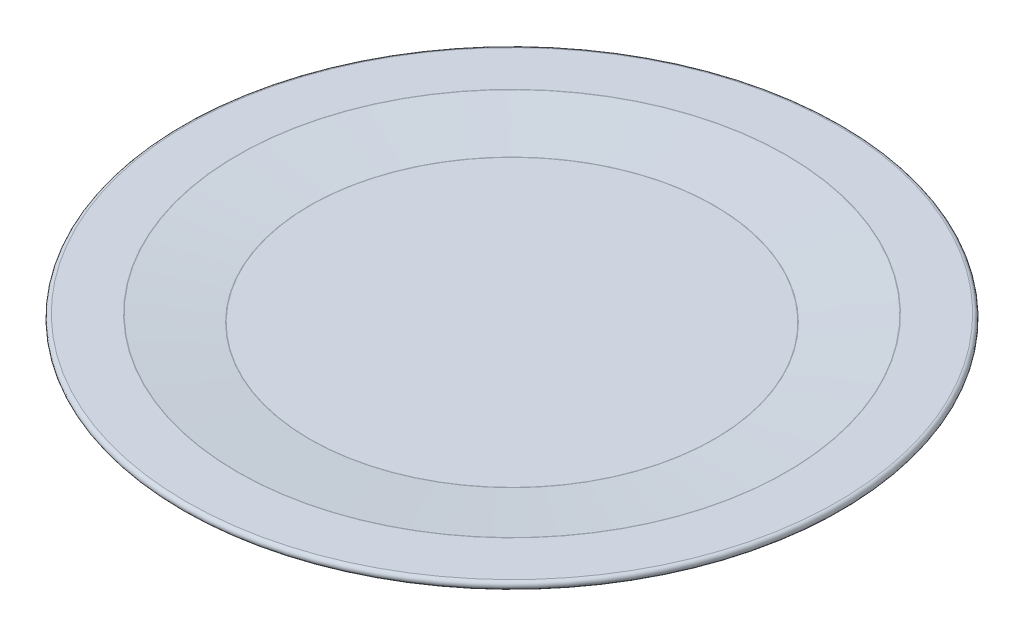
from build123d import *

# Parameters (mm, degrees)
SKETCH1_R           = 203.2
BOSS_EXTRUDE1_DEPTH = 12.7
BOSS_EXTRUDE1_DRAFT = -63.999999999
SKETCH2_R           = 183.871225213
CUT_EXTRUDE1_DEPTH  = 5.08
CUT_EXTRUDE1_DRAFT  = -83.999999999
FILLET1_R           = 2.54
SCALE1_SCALE        = 0.582


with BuildPart() as part:
    # Sketch1 → Boss-Extrude1 (with draft: the straight prism first)
    with BuildSketch(Plane(origin=(0, 0, 0), x_dir=(1, 0, 0), z_dir=(0, 1, 0))):
        Circle(SKETCH1_R)
    extrude(amount=BOSS_EXTRUDE1_DEPTH)
    # Boss-Extrude1: the draft: its side faces are tilted about the plane it starts from
    boss_extrude1_sides = [part.faces().sort_by_distance(p)[0] for p in [
        (-203.2, 6.35, 0),
    ]]
    draft(boss_extrude1_sides, Plane(origin=(0, 0, 0), x_dir=(1, 0, 0), z_dir=(0, 1, 0)), BOSS_EXTRUDE1_DRAFT)


with BuildPart() as cut_extrude1_tool:
    # Sketch2 → Cut-Extrude1 (with draft: the straight prism first)
    with BuildSketch(Plane(origin=(0, 12.7, 0), x_dir=(1, 0, 0), z_dir=(0, 1, 0))):
        Circle(SKETCH2_R)
    extrude(amount=-CUT_EXTRUDE1_DEPTH)
    # Cut-Extrude1: the draft: its side faces are tilted about the plane it starts from
    cut_extrude1_sides = [cut_extrude1_tool.faces().sort_by_distance(p)[0] for p in [
        (-183.871225213, 10.16, 0),
    ]]
    draft(cut_extrude1_sides, Plane(origin=(0, 12.7, 0), x_dir=(1, 0, 0), z_dir=(0, 1, 0)), CUT_EXTRUDE1_DRAFT)


with BuildPart() as part_1:
    add(part.part)

    # Cut-Extrude1: cut by cut_extrude1_tool
    add(cut_extrude1_tool.part, mode=Mode.SUBTRACT)

    # Fillet1
    fillet1_edges = [part_1.edges().sort_by_distance(p)[0] for p in [
        (-229.238858787, 12.7, 0),
        (-135.53825379, 7.62, 0),
        (-183.871225213, 12.7, 0),
    ]]
    fillet(fillet1_edges, radius=FILLET1_R)


with BuildPart() as part_2:
    # Scale1: scaled about (0, 5.422815949, 0)
    add(part_1.part.scale(SCALE1_SCALE).moved(Location((0, 2.266737067, 0))))


solid = part_2.part
